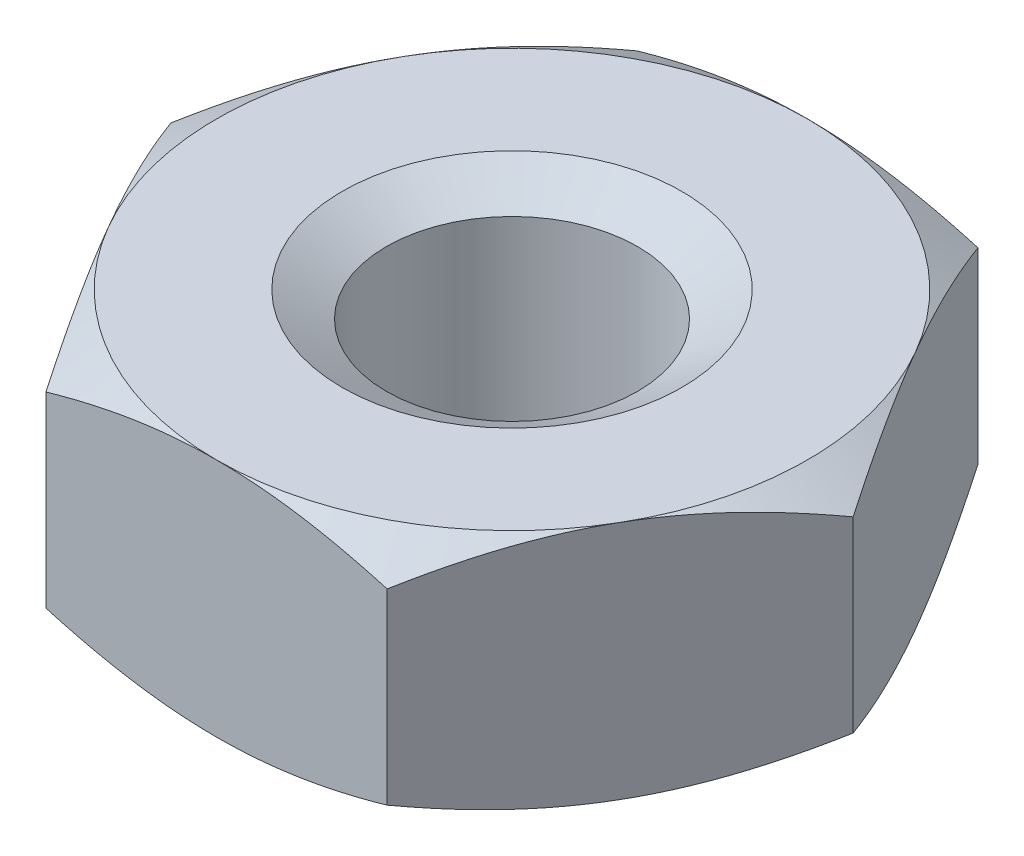
from build123d import *

# Parameters (mm, degrees)
VYSUNOUT1_DEPTH          = 0.65
SKICA3_R                 = 0.68
ODEBRAT_VYSUNUT_M1_DEPTH = 3.768272626


with BuildPart() as part:
    # Skica1 → Vysunout1 (new, symmetric)
    with BuildSketch(Plane(origin=(0, 0, 0), x_dir=(1, 0, 0), z_dir=(0, 1, 0))):
        Polygon((1.847520861, 0), (0.923760431, 1.6), (-0.923760431, 1.6), (-1.847520861, 0), (-0.923760431, -1.6), (0.923760431, -1.6), align=None)
    extrude(amount=VYSUNOUT1_DEPTH, both=True)

    # Skica2 → Odebrat otočením1 (revolve, cut)
    with BuildSketch(Plane(origin=(0, 0, 0), x_dir=(0, 0, -1), z_dir=(1, 0, 0))):
        Polygon((2.725833025, 0.65), (1.6, 0.65), (2.725833025, 0), align=None)
        Polygon((2.725833025, -0.65), (2.725833025, 0), (1.6, -0.65), align=None)
    revolve(axis=Axis((0, 0.65, 0), (0, -1, 0)), mode=Mode.SUBTRACT)

    # Skica3 → Odebrat vysunutím1 (cut, through all)
    with BuildSketch(Plane(origin=(0, 0.65, 0), x_dir=(-1, 0, 0), z_dir=(0, 1, 0))):
        with Locations(Location((0, 0, 0), (0, 0, 90))):
            Circle(SKICA3_R)
    extrude(amount=-ODEBRAT_VYSUNUT_M1_DEPTH, mode=Mode.SUBTRACT)

    # Odebrat vysunutím2 cone 1 section (through the dimple's axis) → Odebrat vysunutím2 (revolve, cut)
    with BuildSketch(Plane(origin=(0, 0.65, 0), x_dir=(0, 0, 1), z_dir=(1, 0, 0))):
        Polygon((0, 0), (0.92, 0), (0, 0.531162248), align=None)
    odebrat_vysunut_m2 = revolve(axis=Axis((0, 0.65, 0), (0, -1, 0)), mode=Mode.SUBTRACT)

    # Zrcadlit1: Odebrat vysunutím2 across plane
    add(odebrat_vysunut_m2.mirror(Plane.ZX), mode=Mode.SUBTRACT)


solid = part.part
